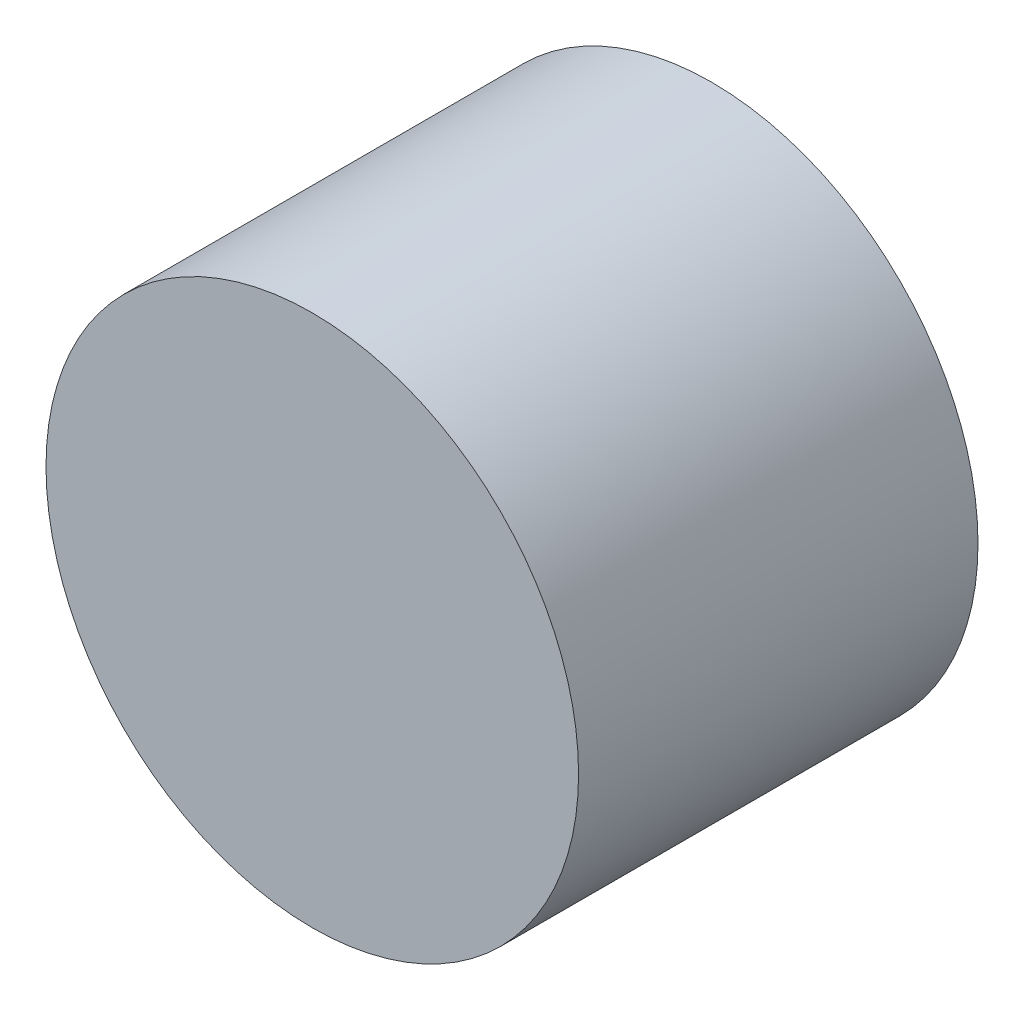
from build123d import *

# Parameters (mm, degrees)
SKETCH1_R           = 2
BOSS_EXTRUDE1_DEPTH = 3


with BuildPart() as part:
    # Sketch1 → Boss-Extrude1 (new body)
    with BuildSketch(Plane.XY):
        with Locations((151.763944171, -0.2)):
            Circle(SKETCH1_R)
    extrude(amount=-BOSS_EXTRUDE1_DEPTH)


solid = part.part
